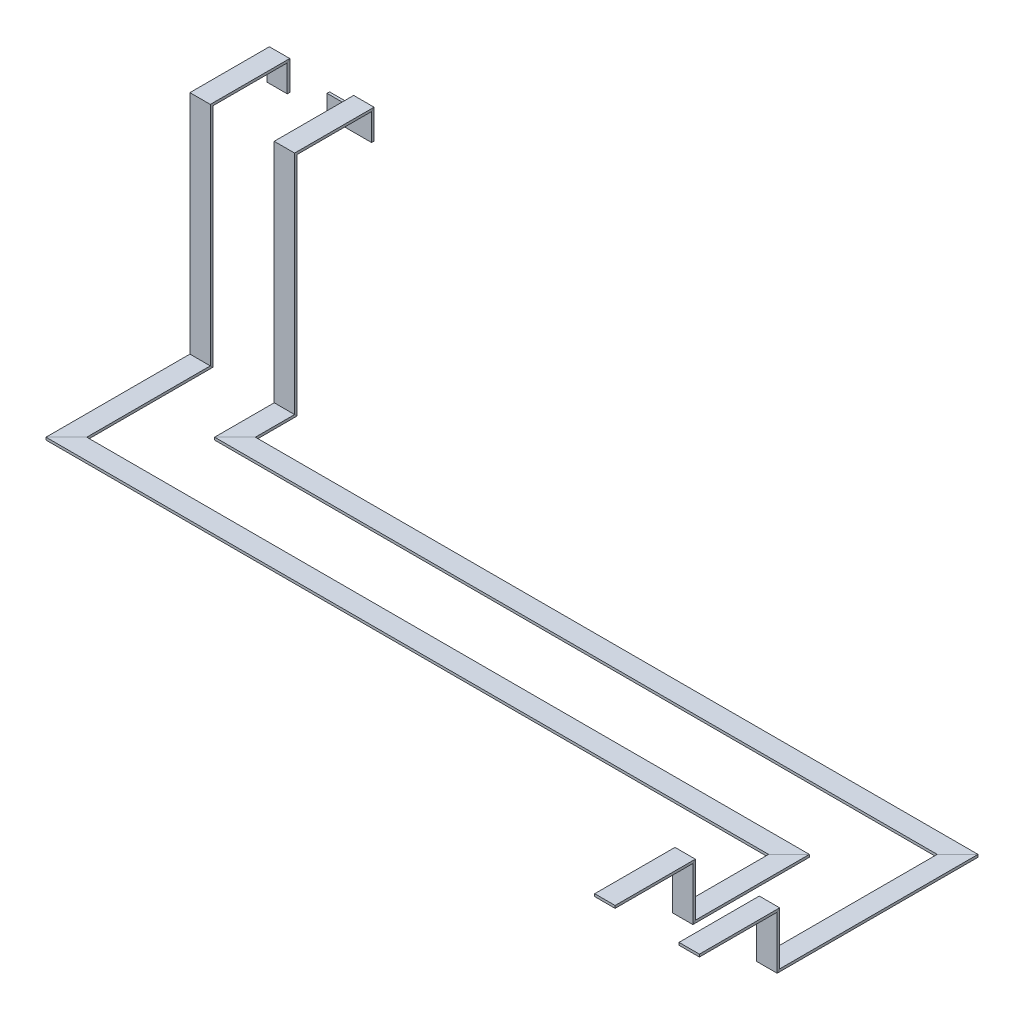
from build123d import *

# Parameters (mm, degrees)
CROQUIS2_W              = 50.8
CROQUIS2_H              = 6.31
CROQUIS3_W              = 50.8
CROQUIS3_H              = 6.31
CROQUIS7_W              = 6.31
CROQUIS7_H              = 50.8
SALIENTE_EXTRUIR1_DEPTH = 60


with BuildPart() as part:
    # Barrer1: sweep along a curve in space
    with BuildLine() as barrer1_path:
        Line((0, 0, 0), (0, -567.24, 0))
        Line((0, -567.24, 0), (0, -567.24, 336.2))
        Line((0, -567.24, 336.2), (1800, -567.24, 336.2))
        Line((1800, -567.24, 336.2), (1800, -567.24, 598))
        Line((1800, -567.24, 598), (1800, -435.47278313, 598))
        Line((1800, -435.47278313, 598), (1800, -435.47278313, 794.782933))
    # Croquis2 → Barrer1 (sweep)
    with BuildSketch(Plane(origin=(0, 0, 0), x_dir=(1, 0, 0), z_dir=(0, 1, 0))):
        Rectangle(CROQUIS2_W, CROQUIS2_H)
        with Locations((210, 0)):
            Rectangle(CROQUIS2_W, CROQUIS2_H)
    sweep(path=barrer1_path.line, transition=Transition.RIGHT)

    # Barrer4: sweep along a curve in space
    with BuildLine() as barrer4_path:
        Line((-0.201028049, -3.155, -3.155), (-0.201028049, -3.155, -191.675))
        Line((-0.201028049, -3.155, -191.675), (-0.201028049, -73.155, -191.675))
    # Croquis3 → Barrer4 (sweep)
    with BuildSketch(Plane(origin=(0, 0, -3.155), x_dir=(-1, 0, 0), z_dir=(0, 0, -1))):
        with Locations((-210, -3.155)):
            Rectangle(CROQUIS3_W, CROQUIS3_H)
        with Locations((0, -3.155)):
            Rectangle(CROQUIS3_W, CROQUIS3_H)
    sweep(path=barrer4_path.line, transition=Transition.RIGHT)

    # Croquis7 → Saliente-Extruir1 (add)
    with BuildSketch(Plane.ZY.offset(-184.6)):
        with Locations((-191.675, -47.755)):
            Rectangle(CROQUIS7_W, CROQUIS7_H)
    extrude(amount=SALIENTE_EXTRUIR1_DEPTH)


solid = part.part
